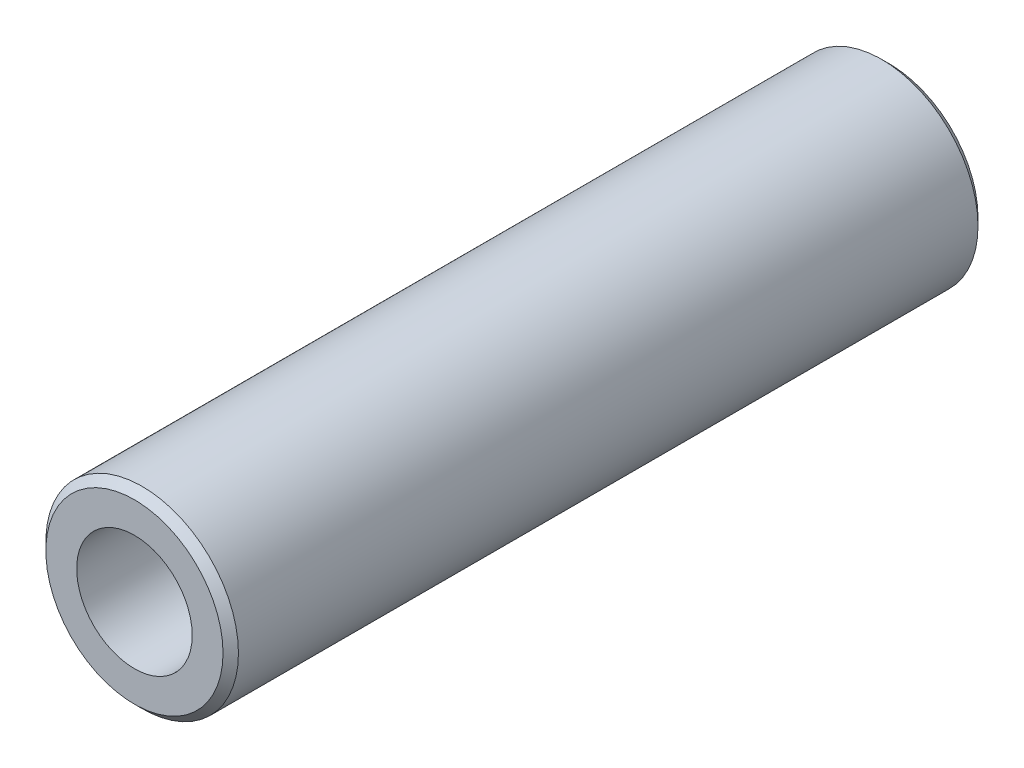
from build123d import *

# Parameters (mm, degrees)
SKETCH1_R           = 6.25
SKETCH1_R_2         = 3.75
EXTRUDE_THIN1_DEPTH = 24.5
CHAMFER1_SIZE       = 0.5
CHAMFER2_SIZE       = 0.5


with BuildPart() as part:
    # Sketch1 → Extrude-Thin1 (new, symmetric)
    with BuildSketch(Plane.XY):
        Circle(SKETCH1_R)
        Circle(SKETCH1_R_2, mode=Mode.SUBTRACT)
    extrude(amount=EXTRUDE_THIN1_DEPTH, both=True)

    # Chamfer1
    chamfer1_edges = [part.edges().sort_by_distance(p)[0] for p in [
        (-6.25, 0, 24.5),
    ]]
    chamfer(chamfer1_edges, length=CHAMFER1_SIZE)

    # Chamfer2
    chamfer2_edges = [part.edges().sort_by_distance(p)[0] for p in [
        (-6.25, 0, -24.5),
    ]]
    chamfer(chamfer2_edges, length=CHAMFER2_SIZE)


solid = part.part
